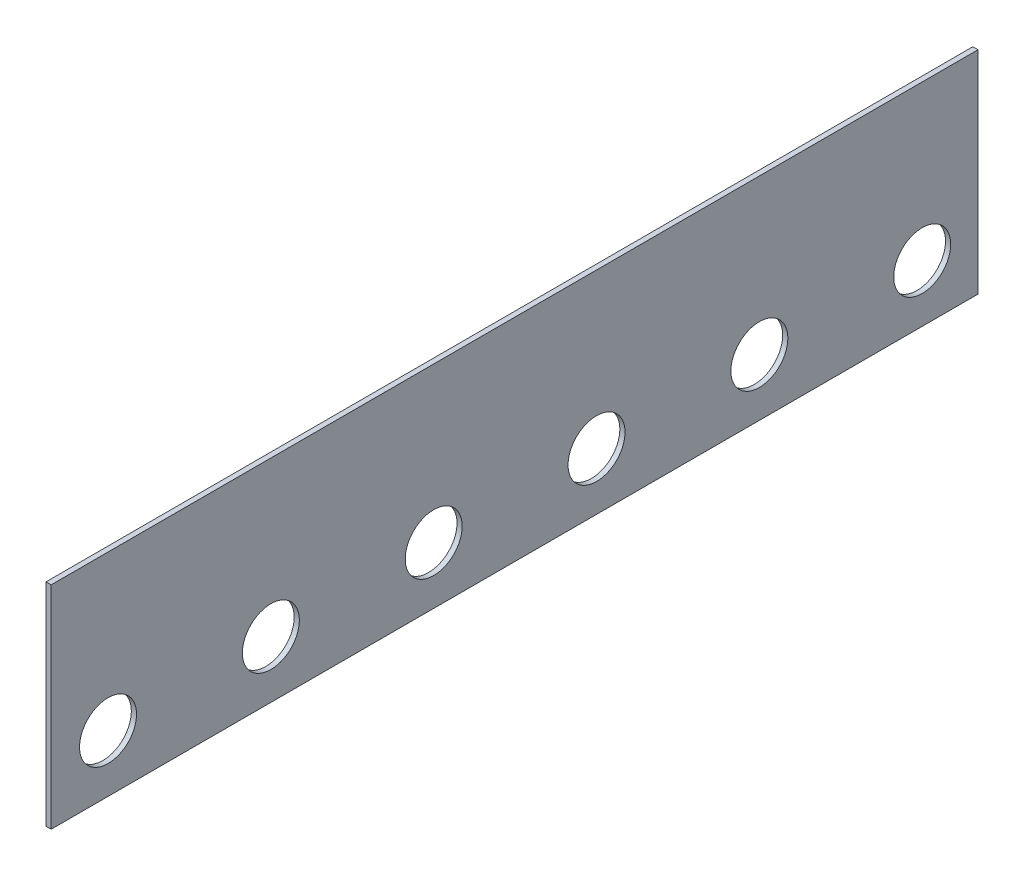
from build123d import *

# Parameters (mm, degrees)
SKETCH1_R           = 17.5
BOSS_EXTRUDE1_DEPTH = 3.175


with BuildPart() as part:
    # Sketch1 → Boss-Extrude1 (new body)
    with BuildSketch(Plane(origin=(0, 0, 0), x_dir=(0, 0, -1), z_dir=(1, 0, 0))):
        with BuildLine():
            Line((-299.628459553, 0), (-299.628459553, -35))
            Line((-299.628459553, -35), (-265.081967213, -35))
            ThreePointArc((-265.081967213, -35), (-265.124051275, -34.999527037), (-265.166134738, -34.999003472))
            Line((-265.166134738, -34.999003472), (269.561502977, -34.999003472))
            Line((269.561502977, -34.999003472), (269.561502977, 7.5))
            Line((269.561502977, 7.5), (269.561502977, 95))
            Line((269.561502977, 95), (-299.628459553, 95))
            Line((-299.628459553, 95), (-299.628459553, 0))
        make_face()
        with Locations((-264.709663373, 0)):
            Circle(SKETCH1_R, mode=Mode.SUBTRACT)
        with Locations((-164.709663373, 0)):
            Circle(SKETCH1_R, mode=Mode.SUBTRACT)
        with Locations((-64.709663373, 0)):
            Circle(SKETCH1_R, mode=Mode.SUBTRACT)
        with Locations((35.290336627, 0)):
            Circle(SKETCH1_R, mode=Mode.SUBTRACT)
        with Locations((135.290336627, 0)):
            Circle(SKETCH1_R, mode=Mode.SUBTRACT)
        with Locations((235.290336627, 0)):
            Circle(SKETCH1_R, mode=Mode.SUBTRACT)
    extrude(amount=BOSS_EXTRUDE1_DEPTH)


solid = part.part
